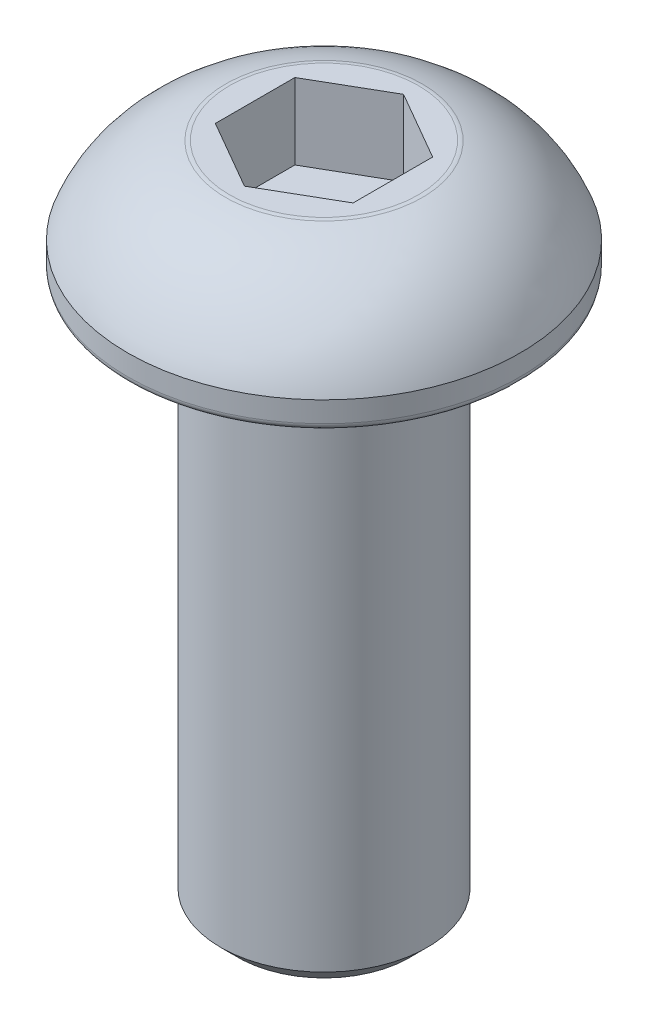
from build123d import *

# Parameters (mm, degrees)
CUT_EXTRUDE1_DEPTH = 1.1


with BuildPart() as part:
    # Sketch1 → Revolve1 (revolve)
    with BuildSketch(Plane.XY, mode=Mode.PRIVATE) as revolve1_sk:
        with BuildLine():
            Line((-1.5, -0.1), (-1.5, -7.75))
            Line((-1.5, -7.75), (-1.25, -8))
            Line((-1.25, -8), (0, -8))
            Line((0, -8), (0, 1.65))
            Line((0, 1.65), (-1.372450351, 1.65))
            ThreePointArc((-1.372450351, 1.65), (-1.400779398, 1.648389744), (-1.42874351, 1.643579721))
            ThreePointArc((-1.42874351, 1.643579721), (-2.295395633, 1.200105689), (-2.85, 0.4))
            Line((-2.85, 0.4), (-2.85, 0.1))
            ThreePointArc((-2.85, 0.1), (-2.820710678, 0.029289322), (-2.75, 0))
            Line((-2.75, 0), (-1.6, 0))
            ThreePointArc((-1.6, 0), (-1.529289322, -0.029289322), (-1.5, -0.1))
        make_face()
    revolve(revolve1_sk.sketch.rotate(Axis((0, -8, 0), (0, 1, 0)), 270), axis=Axis((0, -8, 0), (0, 1, 0)))

    # Sketch2 → Cut-Extrude1 (cut)
    with BuildSketch(Plane(origin=(0, 1.65, 0), x_dir=(1, 0, 0), z_dir=(0, 1, 0))):
        Polygon((-1, 0.577350269), (-1, -0.577350269), (0, -1.154700538), (1, -0.577350269), (1, 0.577350269), (0, 1.154700538), align=None)
    extrude(amount=-CUT_EXTRUDE1_DEPTH, mode=Mode.SUBTRACT)


solid = part.part
